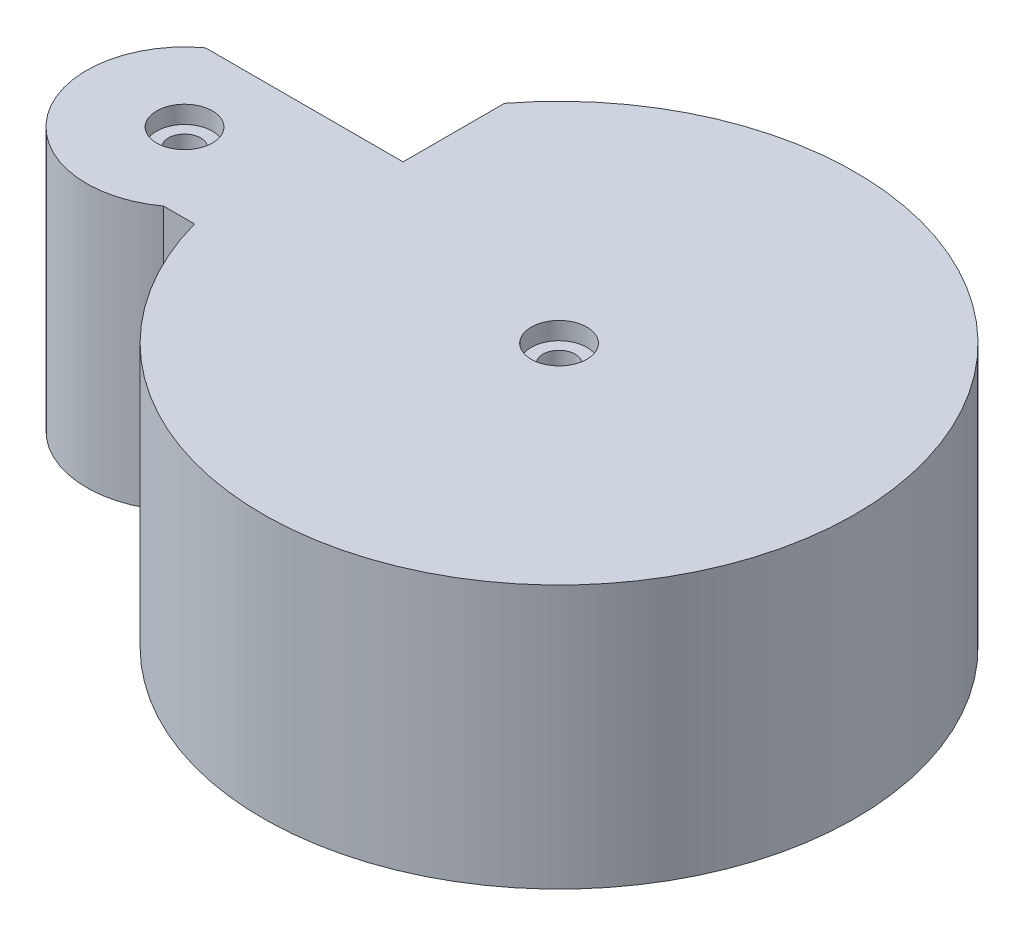
from build123d import *

# Parameters (mm, degrees)
ESQUISSE1_R             = 3.675
BOSS_EXTRU_1_DEPTH      = 60
ESQUISSE2_W             = 50
ESQUISSE2_H             = 29
ENL_V_MAT_EXTRU_1_DEPTH = 40
D_GAGEMENT_M21_D        = 2.6
D_GAGEMENT_M21_DEPTH    = 3.5
ESQUISSE4_R             = 6.35
ENL_V_MAT_EXTRU_2_DEPTH = 4
ENL_V_START             = -4
ESQUISSE5_R             = 6.35
ENL_V_MAT_EXTRU_3_DEPTH = 4
ESQUISSE6_R             = 6.35
ENL_V_MAT_EXTRU_4_DEPTH = 4


with BuildPart() as part:
    # Esquisse1 → Boss.-Extru.1 (new body)
    with BuildSketch(Plane(origin=(0, 0, 0), x_dir=(1, 0, 0), z_dir=(0, 1, 0))):
        with BuildLine():
            ThreePointArc((-98.54472285, 18), (-103.33, -13.21472285), (-72.11527715, -18))
            Line((-72.11527715, -18), (-65.055745327, -18))
            ThreePointArc((-65.055745327, -18), (66.254971265, -12.904603158), (-53.54472285, 41.100032298))
            Line((-53.54472285, 41.100032298), (-53.54472285, 18))
            Line((-53.54472285, 18), (-98.54472285, 18))
        make_face()
        with Locations(Location((-85.33, 0, 0), (0, 0, 270))):
            Circle(ESQUISSE1_R, mode=Mode.SUBTRACT)
        with Locations(Location((0, 0, 0), (0, 0, 270))):
            Circle(ESQUISSE1_R, mode=Mode.SUBTRACT)
    extrude(amount=BOSS_EXTRU_1_DEPTH)

    # Esquisse2 → Enlèv. mat.-Extru.1 (cut)
    with BuildSketch(Plane.XZ):
        with Locations((-71.58, 0)):
            Rectangle(ESQUISSE2_W, ESQUISSE2_H)
    extrude(amount=-ENL_V_MAT_EXTRU_1_DEPTH, mode=Mode.SUBTRACT)

    # Dégagement M21
    with Locations(Plane(origin=(-57.33, 24.6, -18), x_dir=(-1, 0, 0), z_dir=(0, 0, -1))):
        with Locations((0, 0), (24, 0), (24, -12), (0, -12)):
            Hole(D_GAGEMENT_M21_D / 2, depth=D_GAGEMENT_M21_DEPTH)

    # Esquisse4 → Enlèv. mat.-Extru.2 (cut)
    with BuildSketch(Plane.XZ):
        with Locations(Location((0, 0, 0), (0, 0, 270))):
            Circle(ESQUISSE4_R)
    extrude(amount=-ENL_V_MAT_EXTRU_2_DEPTH, mode=Mode.SUBTRACT)

    # Esquisse5 → Enlèv. mat.-Extru.3 (cut)
    with BuildSketch(Plane(origin=(0, 60, 0), x_dir=(1, 0, 0), z_dir=(0, 1, 0)).offset(ENL_V_START)):
        with Locations(Location((0, 0, 0), (0, 0, 90))):
            Circle(ESQUISSE5_R)
    extrude(amount=ENL_V_MAT_EXTRU_3_DEPTH, mode=Mode.SUBTRACT)

    # Esquisse6 → Enlèv. mat.-Extru.4 (cut)
    with BuildSketch(Plane(origin=(0, 60, 0), x_dir=(1, 0, 0), z_dir=(0, 1, 0))):
        with Locations(Location((-85.33, 0, 0), (0, 0, 270))):
            Circle(ESQUISSE6_R)
    extrude(amount=-ENL_V_MAT_EXTRU_4_DEPTH, mode=Mode.SUBTRACT)


solid = part.part
